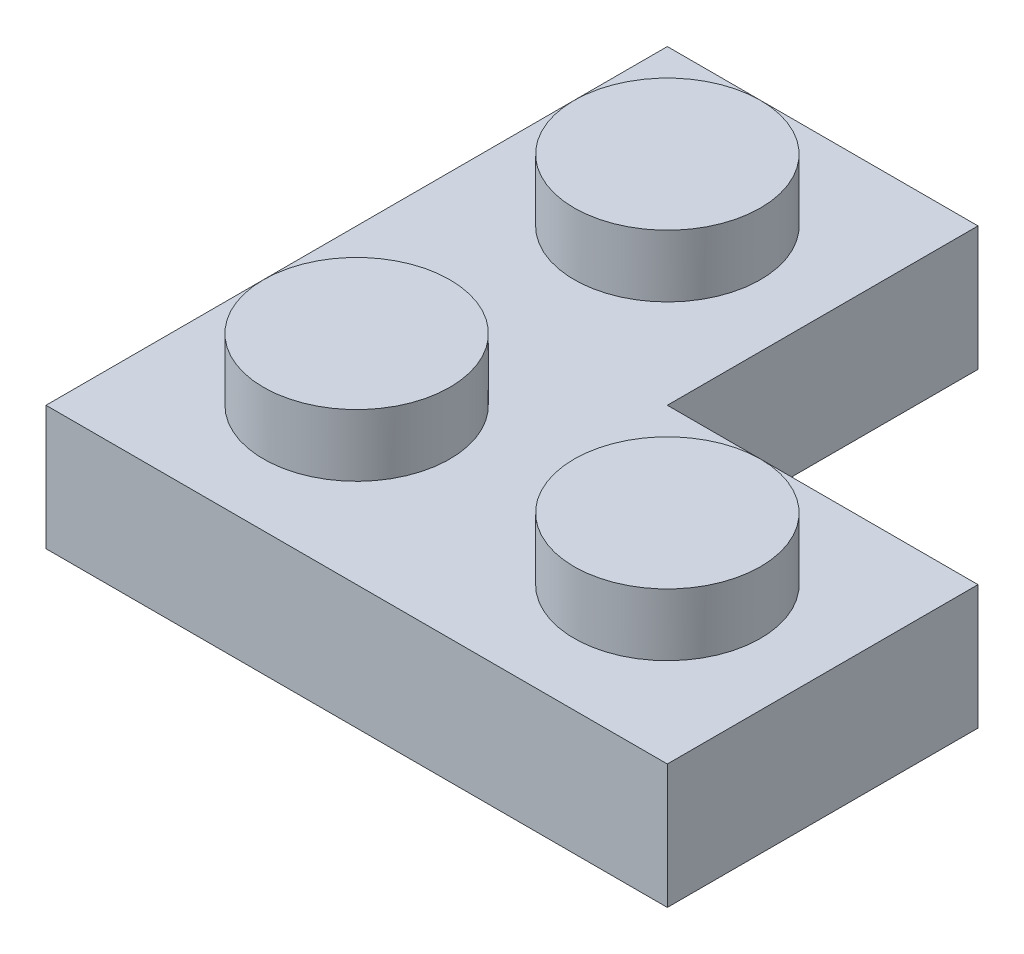
from build123d import *

# Parameters (mm, degrees)
BOSS_EXTRUDE1_DEPTH = 3.2
SKETCH2_R           = 2.4
BOSS_EXTRUDE2_DEPTH = 1.6
SHELL1_T            = -1.6


with BuildPart() as part:
    # Sketch1 → Boss-Extrude1 (new body)
    with BuildSketch(Plane(origin=(0, 0, 0), x_dir=(1, 0, 0), z_dir=(0, 1, 0))):
        Polygon((0, 0), (0, 16), (8, 16), (8, 8), (16, 8), (16, 0), align=None)
    extrude(amount=BOSS_EXTRUDE1_DEPTH)

    # Sketch2 → Boss-Extrude2 (add)
    with BuildSketch(Plane(origin=(0, 3.2, 0), x_dir=(1, 0, 0), z_dir=(0, 1, 0))):
        with Locations(Location((4, 4, 0), (0, 0, 90))):
            Circle(SKETCH2_R)
        with Locations(Location((4, 12, 0), (0, 0, 90))):
            Circle(SKETCH2_R)
        with Locations(Location((12, 4, 0), (0, 0, 90))):
            Circle(SKETCH2_R)
    extrude(amount=BOSS_EXTRUDE2_DEPTH)

    # Shell1
    shell1_openings = [part.faces().sort_by_distance(p)[0] for p in [
        (6.666666667, 0, -6.666666667),
    ]]
    offset(amount=SHELL1_T, openings=shell1_openings, kind=Kind.INTERSECTION)


solid = part.part
